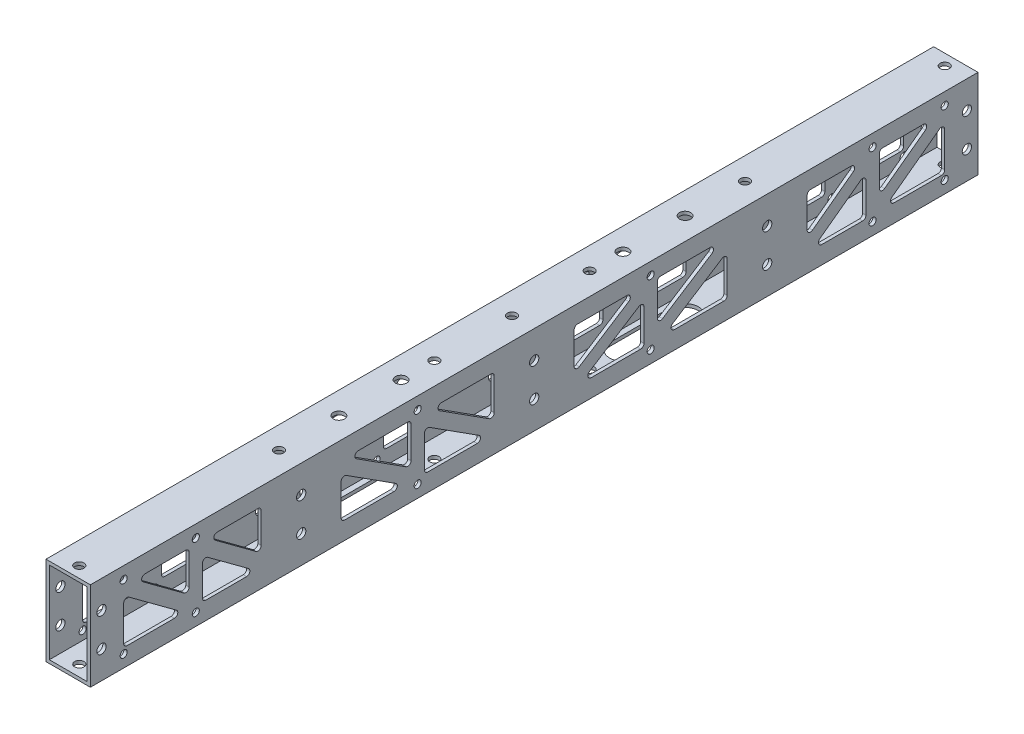
from build123d import *

# Parameters (mm, degrees)
SKETCH_1_W          = 20
SKETCH_1_H          = 40
SKETCH_1_W_2        = 17
SKETCH_1_H_2        = 37
EXTRUDE_1_DEPTH     = 200
CUT_EXTRUDE_1_DEPTH = 15
FILLET_1_R          = 1.5
FILLET_2_R          = 1.5
SKETCH_3_R          = 2.1
CUT_EXTRUDE_2_DEPTH = 202.990098767
SKETCH_4_R          = 1.6
CUT_EXTRUDE_3_DEPTH = 202.990098767
SKETCH_5_R          = 2.1
CUT_EXTRUDE_4_DEPTH = 205.205778567
SKETCH_6_R          = 2.55
CUT_EXTRUDE_5_DEPTH = 205.205778567
CUT_EXTRUDE_6_REACH = 206.206


with BuildPart() as part:
    # 草图1 → 凸台-拉伸1 (new, symmetric)
    with BuildSketch(Plane.XY):
        Rectangle(SKETCH_1_W, SKETCH_1_H)
        Rectangle(SKETCH_1_W_2, SKETCH_1_H_2, mode=Mode.SUBTRACT)
    extrude(amount=EXTRUDE_1_DEPTH, both=True)

    # 草图2 → 切除-拉伸1 (cut, symmetric)
    with BuildSketch(Plane(origin=(0, 0, 0), x_dir=(0, 0, -1), z_dir=(1, 0, 0))):
        Polygon((-185, -12), (-157.550139231, -12), (-185, 8.270666414), align=None)
        Polygon((-155.5, -6.055281799), (-155.5, 12), (-179.949860769, 12), align=None)
        Polygon((-149.5, -12), (-125.050139231, -12), (-149.5, 6.055281799), align=None)
        Polygon((-123, -6.055281799), (-123, 12), (-147.449860769, 12), align=None)
        Polygon((-87, 6.518202701), (-87, -12), (-58.06530828, -12), align=None)
        Polygon((-55.5, 12), (-84.43469172, 12), (-55.5, -6.518202701), align=None)
        Polygon((-49.5, 6.518202701), (-49.5, -12), (-20.56530828, -12), align=None)
        Polygon((-18, 12), (-46.93469172, 12), (-18, -6.518202701), align=None)
        Polygon((49.5, 6.518202701), (20.56530828, -12), (49.5, -12), align=None)
        Polygon((46.93469172, 12), (18, 12), (18, -6.518202701), align=None)
        Polygon((84.43469172, 12), (55.5, 12), (55.5, -6.518202701), align=None)
        Polygon((87, 6.518202701), (58.06530828, -12), (87, -12), align=None)
        Polygon((147.449860769, 12), (123, 12), (123, -6.055281799), align=None)
        Polygon((149.5, 6.055281799), (125.050139231, -12), (149.5, -12), align=None)
        Polygon((179.949860769, 12), (155.5, 12), (155.5, -6.055281799), align=None)
        Polygon((185, 8.270666414), (157.550139231, -12), (185, -12), align=None)
    extrude(amount=CUT_EXTRUDE_1_DEPTH, both=True, mode=Mode.SUBTRACT)

    # 圆角1
    fillet_1_edges = [part.edges().sort_by_distance(p)[0] for p in [
        (9.25, 12, 84.43469172),
        (9.25, 12, 55.5),
        (9.25, -6.518202701, 55.5),
        (9.25, -12, 49.5),
        (9.25, 6.518202701, 49.5),
        (9.25, -12, 20.56530828),
        (9.25, 12, 46.93469172),
        (9.25, 12, 18),
        (9.25, -6.518202701, 18),
        (9.25, 6.518202701, -49.5),
        (9.25, -12, -49.5),
        (9.25, -12, -20.56530828),
        (9.25, -6.055281799, 155.5),
        (9.25, 12, 179.949860769),
        (9.25, 12, 155.5),
        (9.25, 6.055281799, 149.5),
        (9.25, -12, 125.050139231),
        (9.25, -12, 149.5),
        (9.25, 12, 123),
        (9.25, -6.055281799, 123),
        (9.25, 12, 147.449860769),
        (9.25, 6.518202701, 87),
        (9.25, -12, 58.06530828),
        (9.25, -12, 87),
        (9.25, 6.055281799, -149.5),
        (9.25, -12, -149.5),
        (9.25, -12, -125.050139231),
        (9.25, -6.055281799, -155.5),
        (9.25, 12, -155.5),
        (9.25, 12, -179.949860769),
        (9.25, -12, -157.550139231),
        (9.25, 8.270666414, -185),
        (9.25, -12, -185),
        (9.25, -6.518202701, -18),
        (9.25, 12, -18),
        (9.25, 12, -46.93469172),
        (9.25, -6.518202701, -55.5),
        (9.25, 12, -55.5),
        (9.25, 12, -84.43469172),
        (9.25, 6.518202701, -87),
        (9.25, -12, -87),
        (9.25, -12, -58.06530828),
        (9.25, -6.055281799, -123),
        (9.25, 12, -123),
        (9.25, 12, -147.449860769),
        (9.25, 8.270666414, 185),
        (9.25, -12, 157.550139231),
        (9.25, -12, 185),
    ]]
    fillet(fillet_1_edges, radius=FILLET_1_R)

    # 圆角2
    fillet_2_edges = [part.edges().sort_by_distance(p)[0] for p in [
        (-9.25, 12, 84.43469172),
        (-9.25, 12, 55.5),
        (-9.25, -6.518202701, 55.5),
        (-9.25, -12, 49.5),
        (-9.25, 6.518202701, 49.5),
        (-9.25, -12, 20.56530828),
        (-9.25, 12, 46.93469172),
        (-9.25, 12, 18),
        (-9.25, -6.518202701, 18),
        (-9.25, 6.518202701, -49.5),
        (-9.25, -12, -49.5),
        (-9.25, -12, -20.56530828),
        (-9.25, -6.055281799, 155.5),
        (-9.25, 12, 179.949860769),
        (-9.25, 12, 155.5),
        (-9.25, 6.055281799, 149.5),
        (-9.25, -12, 125.050139231),
        (-9.25, -12, 149.5),
        (-9.25, 12, 123),
        (-9.25, -6.055281799, 123),
        (-9.25, 12, 147.449860769),
        (-9.25, 6.518202701, 87),
        (-9.25, -12, 58.06530828),
        (-9.25, -12, 87),
        (-9.25, 6.055281799, -149.5),
        (-9.25, -12, -149.5),
        (-9.25, -12, -125.050139231),
        (-9.25, -6.055281799, -155.5),
        (-9.25, 12, -155.5),
        (-9.25, 12, -179.949860769),
        (-9.25, -12, -157.550139231),
        (-9.25, 8.270666414, -185),
        (-9.25, -12, -185),
        (-9.25, -6.518202701, -18),
        (-9.25, 12, -18),
        (-9.25, 12, -46.93469172),
        (-9.25, -6.518202701, -55.5),
        (-9.25, 12, -55.5),
        (-9.25, 12, -84.43469172),
        (-9.25, 6.518202701, -87),
        (-9.25, -12, -87),
        (-9.25, -12, -58.06530828),
        (-9.25, -6.055281799, -123),
        (-9.25, 12, -123),
        (-9.25, 12, -147.449860769),
        (-9.25, 8.270666414, 185),
        (-9.25, -12, 157.550139231),
        (-9.25, -12, 185),
    ]]
    fillet(fillet_2_edges, radius=FILLET_2_R)

    # 草图3 → 切除-拉伸2 (cut, through all)
    with BuildSketch(Plane.ZY.offset(10)):
        with Locations(Location((-195, -7.5, 0), (0, 0, 270))):
            Circle(SKETCH_3_R)
        with Locations(Location((-195, 7.5, 0), (0, 0, 270))):
            Circle(SKETCH_3_R)
        with Locations(Location((-105, 7.5, 0), (0, 0, 270))):
            Circle(SKETCH_3_R)
        with Locations(Location((-105, -7.5, 0), (0, 0, 270))):
            Circle(SKETCH_3_R)
        with Locations(Location((0, -7.5, 0), (0, 0, 270))):
            Circle(SKETCH_3_R)
        with Locations(Location((0, 7.5, 0), (0, 0, 270))):
            Circle(SKETCH_3_R)
        with Locations(Location((105, 7.5, 0), (0, 0, 270))):
            Circle(SKETCH_3_R)
        with Locations(Location((105, -7.5, 0), (0, 0, 270))):
            Circle(SKETCH_3_R)
        with Locations(Location((195, -7.5, 0), (0, 0, 270))):
            Circle(SKETCH_3_R)
        with Locations(Location((195, 7.5, 0), (0, 0, 270))):
            Circle(SKETCH_3_R)
    extrude(amount=-CUT_EXTRUDE_2_DEPTH, mode=Mode.SUBTRACT)

    # 草图4 → 切除-拉伸3 (cut, through all)
    with BuildSketch(Plane(origin=(10, 0, 0), x_dir=(0, 0, -1), z_dir=(1, 0, 0))):
        with Locations(Location((-152.5, -14.5, 0), (0, 0, 90))):
            Circle(SKETCH_4_R)
        with Locations(Location((-52.5, -14.5, 0), (0, 0, 90))):
            Circle(SKETCH_4_R)
        with Locations(Location((52.5, -14.5, 0), (0, 0, 90))):
            Circle(SKETCH_4_R)
        with Locations(Location((152.5, -14.5, 0), (0, 0, 90))):
            Circle(SKETCH_4_R)
        with Locations(Location((152.5, 14.5, 0), (0, 0, 90))):
            Circle(SKETCH_4_R)
        with Locations(Location((52.5, 14.5, 0), (0, 0, 90))):
            Circle(SKETCH_4_R)
        with Locations(Location((-52.5, 14.5, 0), (0, 0, 90))):
            Circle(SKETCH_4_R)
        with Locations(Location((-152.5, 14.5, 0), (0, 0, 90))):
            Circle(SKETCH_4_R)
        with Locations(Location((185, -14.5, 0), (0, 0, 90))):
            Circle(SKETCH_4_R)
        with Locations(Location((185, 14.5, 0), (0, 0, 90))):
            Circle(SKETCH_4_R)
        with Locations(Location((-185, -14.5, 0), (0, 0, 90))):
            Circle(SKETCH_4_R)
        with Locations(Location((-185, 14.5, 0), (0, 0, 90))):
            Circle(SKETCH_4_R)
    extrude(amount=-CUT_EXTRUDE_3_DEPTH, mode=Mode.SUBTRACT)

    # 草图5 → 切除-拉伸4 (cut, through all)
    with BuildSketch(Plane(origin=(0, 20, 0), x_dir=(1, 0, 0), z_dir=(0, 1, 0))):
        with Locations(Location((0, -105, 0), (0, 0, 270))):
            Circle(SKETCH_5_R)
        with Locations(Location((0, 0, 0), (0, 0, 270))):
            Circle(SKETCH_5_R)
        with Locations(Location((0, 105, 0), (0, 0, 270))):
            Circle(SKETCH_5_R)
        with Locations(Location((0, 195, 0), (0, 0, 270))):
            Circle(SKETCH_5_R)
        with Locations(Location((0, -195, 0), (0, 0, 270))):
            Circle(SKETCH_5_R)
        with Locations(Location((0, -35, 0), (0, 0, 270))):
            Circle(SKETCH_5_R)
        with Locations(Location((0, 35, 0), (0, 0, 270))):
            Circle(SKETCH_5_R)
    extrude(amount=-CUT_EXTRUDE_4_DEPTH, mode=Mode.SUBTRACT)

    # 草图6 → 切除-拉伸5 (cut, through all)
    with BuildSketch(Plane(origin=(0, 20, 0), x_dir=(1, 0, 0), z_dir=(0, 1, 0))):
        with Locations(Location((0, -78, 0), (0, 0, 270))):
            Circle(SKETCH_6_R)
        with Locations(Location((0, -50, 0), (0, 0, 270))):
            Circle(SKETCH_6_R)
        with Locations(Location((0, 50, 0), (0, 0, 270))):
            Circle(SKETCH_6_R)
        with Locations(Location((0, 78, 0), (0, 0, 270))):
            Circle(SKETCH_6_R)
    extrude(amount=-CUT_EXTRUDE_5_DEPTH, mode=Mode.SUBTRACT)

    # 草图7 → 切除-拉伸6 (cut, up to next)
    with BuildSketch(Plane.XZ.offset(20), mode=Mode.PRIVATE) as cut_extrude_6_sk1:
        with BuildLine():
            Line((6, 78), (6, 50))
            ThreePointArc((6, 50), (0, 44), (-6, 50))
            Line((-6, 50), (-6, 78))
            ThreePointArc((-6, 78), (0, 84), (6, 78))
        make_face()
    cut_extrude_6_tool1 = extrude(cut_extrude_6_sk1.sketch, amount=-CUT_EXTRUDE_6_REACH, mode=Mode.PRIVATE) & part.part
    # 草图7 → 切除-拉伸6 (cut, up to next)
    with BuildSketch(Plane.XZ.offset(20), mode=Mode.PRIVATE) as cut_extrude_6_sk2:
        with BuildLine():
            Line((6, -50), (6, -78))
            ThreePointArc((6, -78), (0, -84), (-6, -78))
            Line((-6, -78), (-6, -50))
            ThreePointArc((-6, -50), (0, -44), (6, -50))
        make_face()
    cut_extrude_6_tool2 = extrude(cut_extrude_6_sk2.sketch, amount=-CUT_EXTRUDE_6_REACH, mode=Mode.PRIVATE) & part.part
    add(cut_extrude_6_tool1.solids().sort_by_distance((0, -20, 64))[0], mode=Mode.SUBTRACT)
    add(cut_extrude_6_tool2.solids().sort_by_distance((0, -20, -64))[0], mode=Mode.SUBTRACT)


solid = part.part
